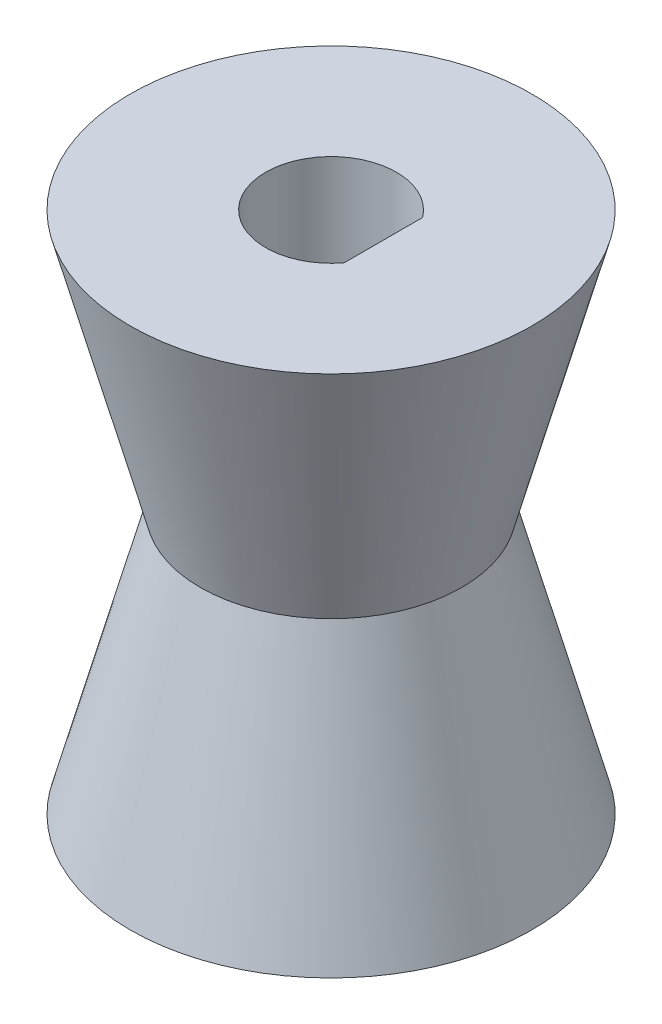
from build123d import *

# Parameters (mm, degrees)
SKETCH_1_R      = 5
EXTRUDE_1_DEPTH = 10
DRAFT_1_ANGLE   = 15
SKETCH_3_R      = 7.679492
EXTRUDE_2_DEPTH = 10
DRAFT_2_ANGLE   = -15


with BuildPart() as part:
    # Эскиз1 → Вытянуть1 (new body)
    with BuildSketch(Plane(origin=(0, 0, 0), x_dir=(1, 0, 0), z_dir=(0, 1, 0))):
        with Locations(Location((0, 0, 0), (0, 0, 270))):
            Circle(SKETCH_1_R)
        with BuildLine():
            Line((2, 1.5), (2, -1.5))
            ThreePointArc((2, -1.5), (-2.5, 0), (2, 1.5))
        make_face(mode=Mode.SUBTRACT)
    extrude(amount=EXTRUDE_1_DEPTH)

    # Уклон1
    draft_1_faces = [part.faces().sort_by_distance(p)[0] for p in [
        (0, 5, -5),
    ]]
    draft(draft_1_faces, Plane.ZX.offset(10), DRAFT_1_ANGLE)

    # Эскиз3 → Вытянуть2 (add)
    with BuildSketch(Plane(origin=(0, 10, 0), x_dir=(1, 0, 0), z_dir=(0, 1, 0))):
        with Locations(Location((0, 0, 0), (0, 0, 270))):
            Circle(SKETCH_3_R)
        with BuildLine():
            Line((2, 1.5), (2, -1.5))
            ThreePointArc((2, -1.5), (-2.5, 0), (2, 1.5))
        make_face(mode=Mode.SUBTRACT)
    extrude(amount=EXTRUDE_2_DEPTH)

    # Уклон2
    draft_2_faces = [part.faces().sort_by_distance(p)[0] for p in [
        (0, 15, -7.679492),
    ]]
    draft(draft_2_faces, Plane.ZX.offset(20), DRAFT_2_ANGLE)


solid = part.part
